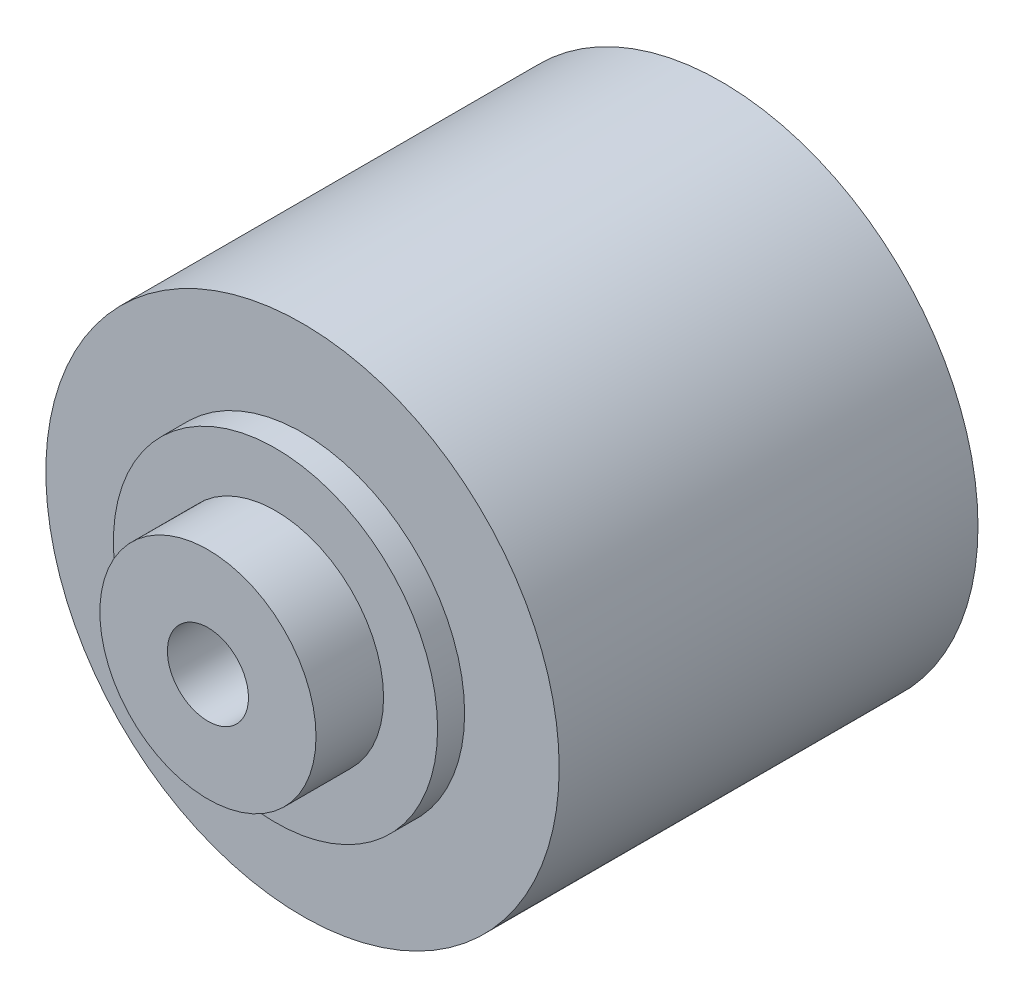
from build123d import *

# Parameters (mm, degrees)
SKETCH_1_R          = 19
EXTRUDE_1_DEPTH     = 31
SKETCH_2_R          = 8
EXTRUDE_2_DEPTH     = 7
SKETCH_3_R          = 3
CUT_EXTRUDE_1_DEPTH = 47.540305113
SKETCH_4_R          = 12
EXTRUDE_3_DEPTH     = 2
SKETCH_5_R          = 10
SKETCH_5_R_2        = 3
EXTRUDE_4_DEPTH     = 1


with BuildPart() as part:
    # 草图1 → 凸台-拉伸1 (new body)
    with BuildSketch(Plane.XY):
        Circle(SKETCH_1_R)
    extrude(amount=EXTRUDE_1_DEPTH)

    # 草图2 → 凸台-拉伸2 (add)
    with BuildSketch(Plane.XY.offset(31)):
        Circle(SKETCH_2_R)
    extrude(amount=EXTRUDE_2_DEPTH)

    # 草图3 → 切除-拉伸1 (cut, through all)
    with BuildSketch(Plane.XY.offset(38)):
        Circle(SKETCH_3_R)
    extrude(amount=-CUT_EXTRUDE_1_DEPTH, mode=Mode.SUBTRACT)

    # 草图4 → 凸台-拉伸3 (add)
    with BuildSketch(Plane.XY.offset(31)):
        Circle(SKETCH_4_R)
    extrude(amount=EXTRUDE_3_DEPTH)

    # 草图5 → 凸台-拉伸4 (add)
    with BuildSketch(Plane(origin=(0, 0, 0), x_dir=(-1, 0, 0), z_dir=(0, 0, -1))):
        with Locations(Location((0, 0, 0), (0, 0, 180))):
            Circle(SKETCH_5_R)
        with Locations(Location((0, 0, 0), (0, 0, 180))):
            Circle(SKETCH_5_R_2, mode=Mode.SUBTRACT)
    extrude(amount=EXTRUDE_4_DEPTH)


solid = part.part
